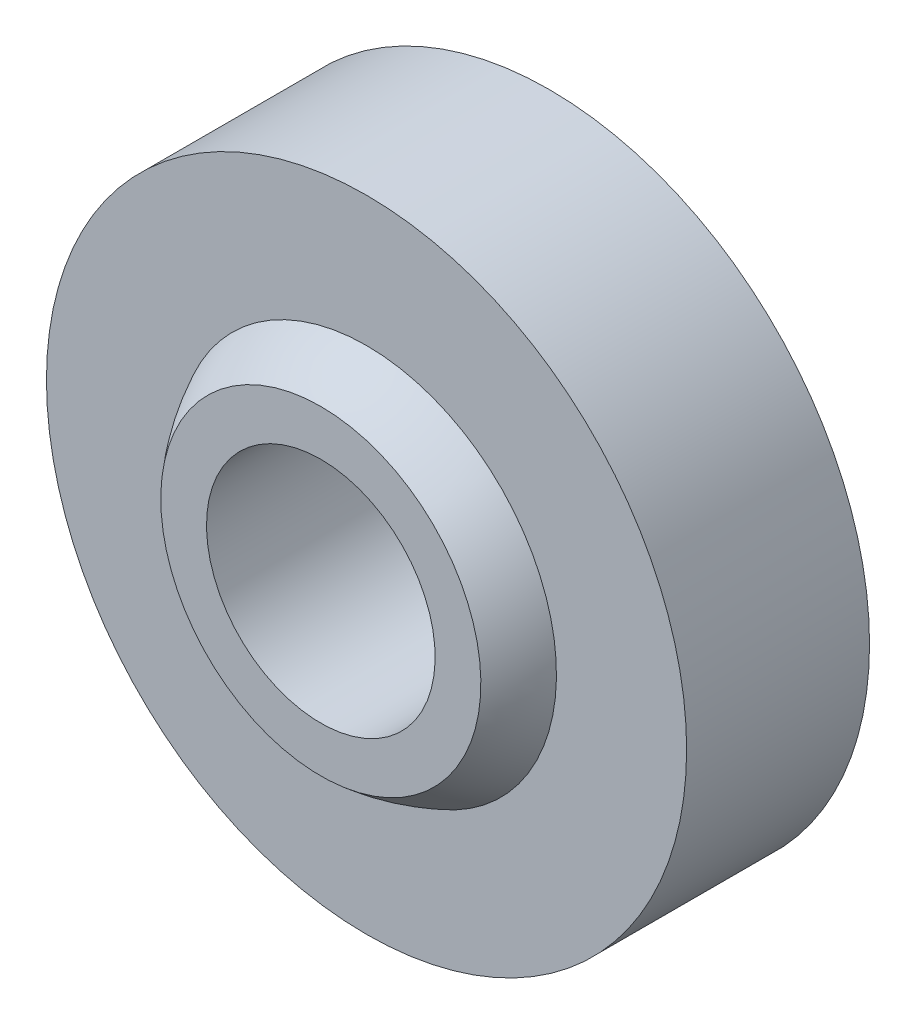
from build123d import *

# Parameters (mm, degrees)
SKETCH_1_R      = 7
SKETCH_1_R_2    = 2.5
EXTRUDE_1_DEPTH = 2


with BuildPart() as part:
    # 草图1 → 凸台-拉伸1 (new, symmetric)
    with BuildSketch(Plane.XY):
        Circle(SKETCH_1_R)
        Circle(SKETCH_1_R_2, mode=Mode.SUBTRACT)
    extrude(amount=EXTRUDE_1_DEPTH, both=True)

    # 草图2 → 旋转1 (revolve)
    with BuildSketch(Plane(origin=(0, 0, 0), x_dir=(0, 0, -1), z_dir=(1, 0, 0))):
        with BuildLine():
            ThreePointArc((-3, 3.5), (0, 4.609772229), (3, 3.5))
            Line((3, 3.5), (3, 2.5))
            Line((3, 2.5), (-3, 2.5))
            Line((-3, 2.5), (-3, 3.5))
        make_face()
    revolve(axis=Axis((0, 0, 0), (0, 0, 1)))


solid = part.part
